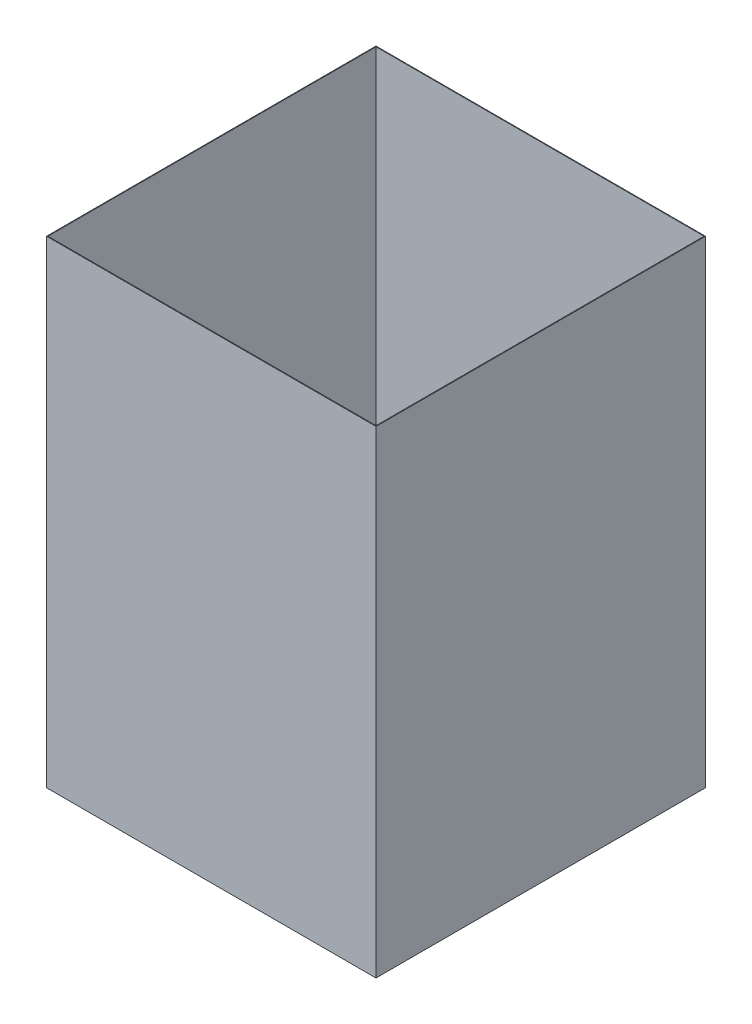
from build123d import *

# Parameters (mm, degrees)
SKETCH1_W           = 200
SKETCH1_H           = 200
BOSS_EXTRUDE1_DEPTH = 290
SHELL1_T            = -0.4


with BuildPart() as part:
    # Sketch1 → Boss-Extrude1 (new body)
    with BuildSketch(Plane(origin=(0, 0, 0), x_dir=(1, 0, 0), z_dir=(0, 1, 0))):
        Rectangle(SKETCH1_W, SKETCH1_H)
    extrude(amount=BOSS_EXTRUDE1_DEPTH)

    # Shell1
    shell1_openings = [part.faces().sort_by_distance(p)[0] for p in [
        (0, 290, 0),
    ]]
    offset(amount=SHELL1_T, openings=shell1_openings, kind=Kind.INTERSECTION)


solid = part.part
